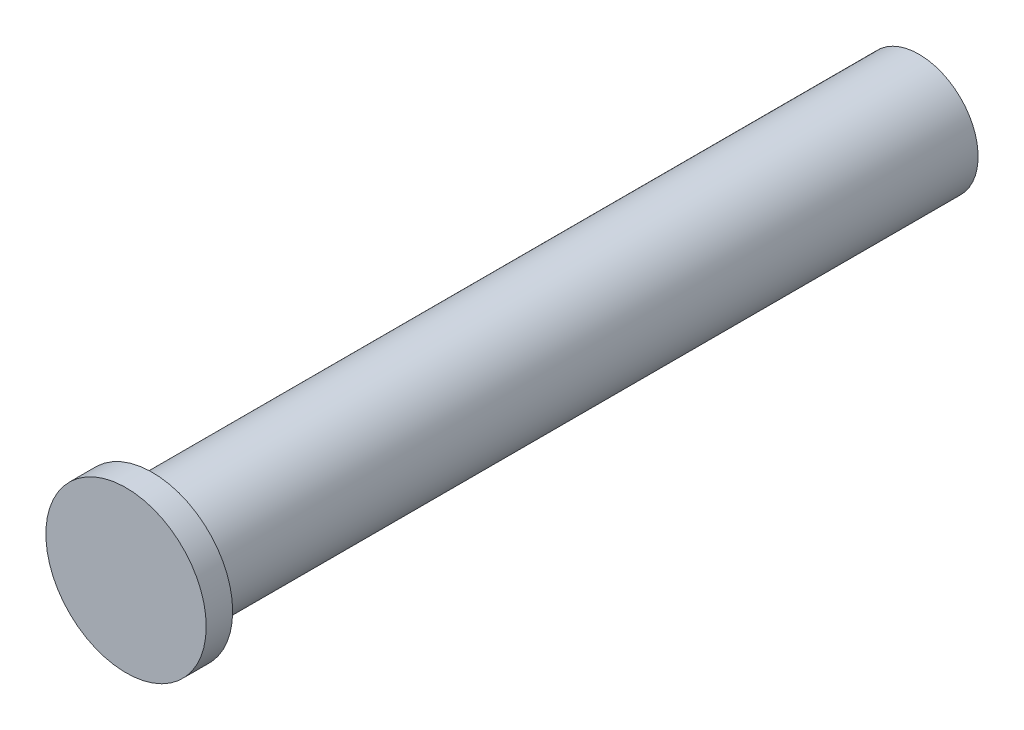
from build123d import *

# Parameters (mm, degrees)
ESBO_O1_R                                   = 9.1
RESSALTO_EXTRUS_O1_DEPTH                    = 3
ESBO_O2_R                                   = 6.7
RESSALTO_EXTRUS_O2_DEPTH                    = 87
FURO_ROSCADO_PARA_CONDU_TE_DE_M4X0_72_D     = 4.2
FURO_ROSCADO_PARA_CONDU_TE_DE_M4X0_72_DEPTH = 22
FURO_ROSCADO_PARA_CONDU_TE_DE_M4X0_72_TIP   = 1.2618073


with BuildPart() as part:
    # Esboço1 → Ressalto-extrusão1 (new body)
    with BuildSketch(Plane.XY):
        Circle(ESBO_O1_R)
    extrude(amount=-RESSALTO_EXTRUS_O1_DEPTH)

    # Esboço2 → Ressalto-extrusão2 (add)
    with BuildSketch(Plane(origin=(0, 0, -3), x_dir=(-1, 0, 0), z_dir=(0, 0, -1))):
        Circle(ESBO_O2_R)
    extrude(amount=RESSALTO_EXTRUS_O2_DEPTH)

    # Furo roscado para conduíte de M4x0.72
    with Locations(Plane(origin=(0, 0, -90), x_dir=(-1, 0, 0), z_dir=(0, 0, -1))):
        with Locations((0, 0)):
            Hole(FURO_ROSCADO_PARA_CONDU_TE_DE_M4X0_72_D / 2, depth=FURO_ROSCADO_PARA_CONDU_TE_DE_M4X0_72_DEPTH)
            with Locations((0, 0, -(FURO_ROSCADO_PARA_CONDU_TE_DE_M4X0_72_DEPTH + FURO_ROSCADO_PARA_CONDU_TE_DE_M4X0_72_TIP / 2))):  # 118° drill point
                Cone(0, FURO_ROSCADO_PARA_CONDU_TE_DE_M4X0_72_D / 2, FURO_ROSCADO_PARA_CONDU_TE_DE_M4X0_72_TIP, mode=Mode.SUBTRACT)


solid = part.part
